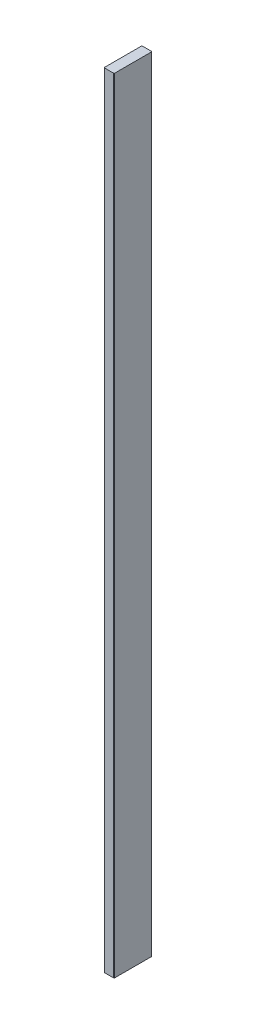
from build123d import *

# Parameters (mm, degrees)
SKETCH1_W           = 32
SKETCH1_H           = 120
BOSS_EXTRUDE1_DEPTH = 2482
FILLET1_R           = 2
SKETCH2_R           = 6
CUT_EXTRUDE1_DEPTH  = 30


with BuildPart() as part:
    # Sketch1 → Boss-Extrude1 (new body)
    with BuildSketch(Plane(origin=(0, 0, 0), x_dir=(1, 0, 0), z_dir=(0, 1, 0))):
        Rectangle(SKETCH1_W, SKETCH1_H)
    extrude(amount=BOSS_EXTRUDE1_DEPTH)

    # Fillet1
    fillet1_edges = [part.edges().sort_by_distance(p)[0] for p in [
        (16, 1241, 60),
        (-16, 1241, 60),
        (-16, 1241, -60),
        (16, 1241, -60),
    ]]
    fillet(fillet1_edges, radius=FILLET1_R)

    # Sketch2 → Cut-Extrude1 (cut)
    with BuildSketch(Plane.XZ):
        with Locations(Location((0, 0, 0), (0, 0, 270))):
            Circle(SKETCH2_R)
    extrude(amount=-CUT_EXTRUDE1_DEPTH, mode=Mode.SUBTRACT)


solid = part.part
